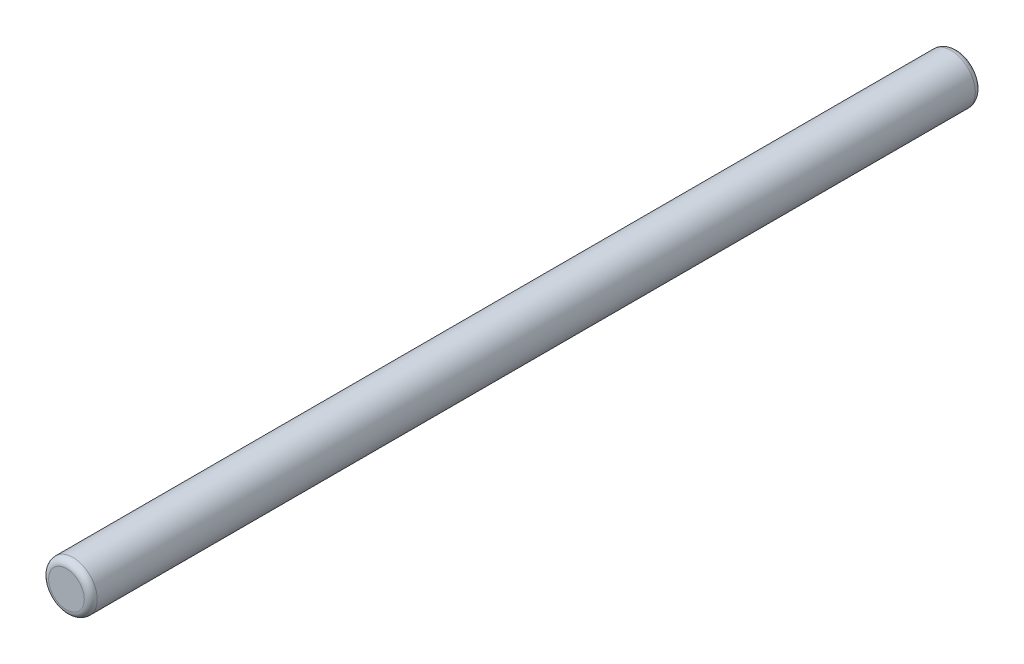
from build123d import *

# Parameters (mm, degrees)
SKETCH1_R           = 7.5
BOSS_EXTRUDE1_DEPTH = 137.5
FILLET1_R           = 2


with BuildPart() as part:
    # Sketch1 → Boss-Extrude1 (new, symmetric)
    with BuildSketch(Plane.XY):
        Circle(SKETCH1_R)
    extrude(amount=BOSS_EXTRUDE1_DEPTH, both=True)

    # Fillet1
    fillet1_edges = [part.edges().sort_by_distance(p)[0] for p in [
        (-7.5, 0, -137.5),
        (-7.5, 0, 137.5),
    ]]
    fillet(fillet1_edges, radius=FILLET1_R)


solid = part.part
